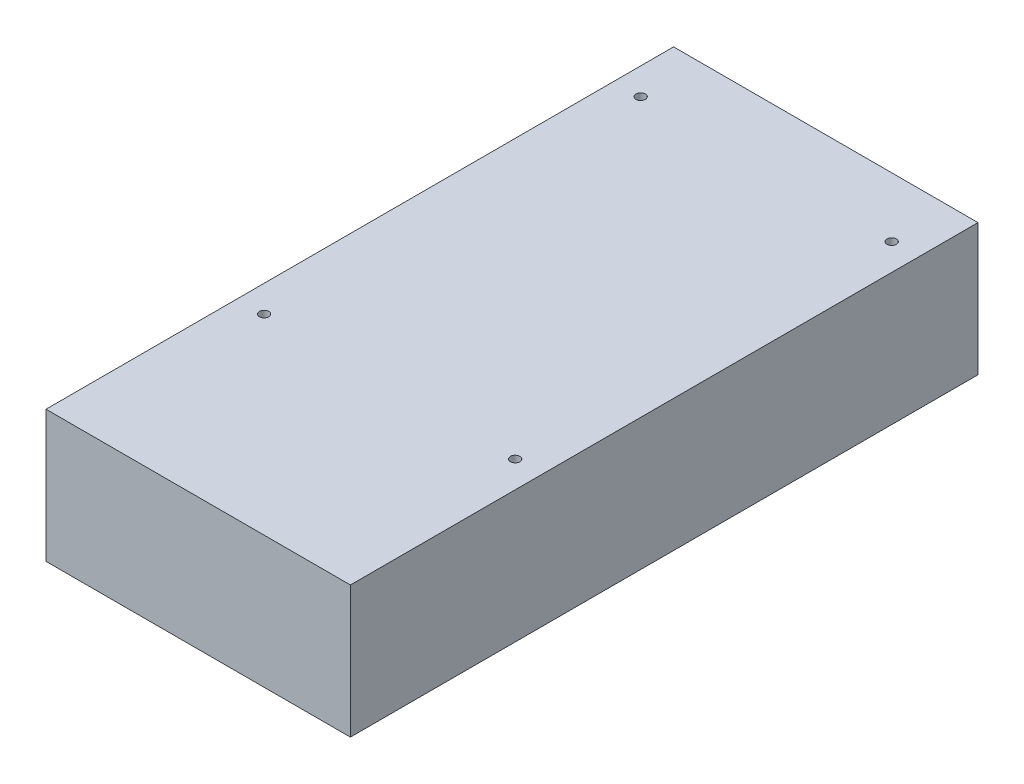
from build123d import *

# Parameters (mm, degrees)
SKETCH1_W           = 97
SKETCH1_H           = 200
BOSS_EXTRUDE1_DEPTH = 42
SKETCH3_R           = 1.5
CUT_EXTRUDE1_DEPTH  = 3


with BuildPart() as part:
    # Sketch1 → Boss-Extrude1 (new body)
    with BuildSketch(Plane(origin=(0, 0, 0), x_dir=(1, 0, 0), z_dir=(0, 1, 0))):
        with Locations((48.5, 100)):
            Rectangle(SKETCH1_W, SKETCH1_H)
    extrude(amount=BOSS_EXTRUDE1_DEPTH)

    # Sketch3 → Cut-Extrude1 (cut)
    with BuildSketch(Plane(origin=(0, 42, 0), x_dir=(1, 0, 0), z_dir=(0, 1, 0))):
        with Locations(Location((88.5, 61, 0), (0, 0, 270))):
            Circle(SKETCH3_R)
        with Locations(Location((8.5, 61, 0), (0, 0, 270))):
            Circle(SKETCH3_R)
        with Locations(Location((88.5, 181, 0), (0, 0, 270))):
            Circle(SKETCH3_R)
        with Locations(Location((8.5, 181, 0), (0, 0, 270))):
            Circle(SKETCH3_R)
    extrude(amount=-CUT_EXTRUDE1_DEPTH, mode=Mode.SUBTRACT)


solid = part.part
